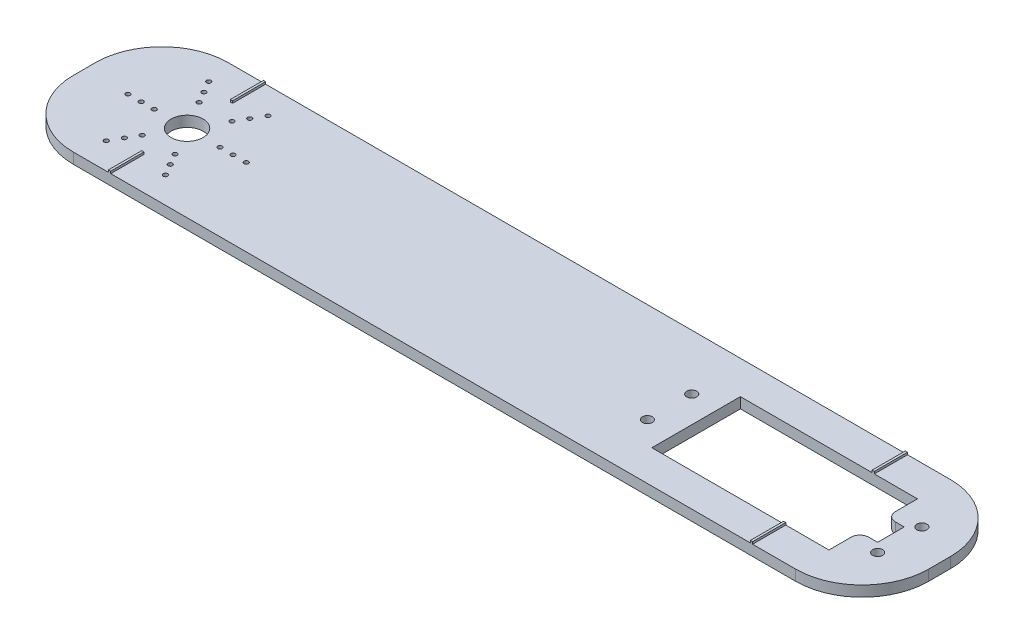
from build123d import *

# Parameters (mm, degrees)
SKETCH1_W           = 193.2
SKETCH1_H           = 35
BOSS_EXTRUDE1_DEPTH = 2.4
SKETCH2_R           = 1.13
SKETCH2_R_2         = 3.625
SKETCH2_R_3         = 0.5
SKETCH2_W           = 40
SKETCH2_H           = 20
CUT_EXTRUDE1_DEPTH  = 2.4
SKETCH4_W           = 4
SKETCH4_H           = 6
CUT_EXTRUDE2_DEPTH  = 2.4
FILLET1_R           = 15
FILLET2_R           = 2
SKETCH5_W           = 0.5
SKETCH5_H           = 7.5
BOSS_EXTRUDE2_DEPTH = 0.5


with BuildPart() as part:
    # Sketch1 → Boss-Extrude1 (new body)
    with BuildSketch(Plane(origin=(0, 0, 0), x_dir=(1, 0, 0), z_dir=(0, 1, 0))):
        with Locations((30.922946176, 21.495750708)):
            Rectangle(SKETCH1_W, SKETCH1_H)
    extrude(amount=BOSS_EXTRUDE1_DEPTH)

    # Sketch2 → Cut-Extrude1 (cut)
    with BuildSketch(Plane(origin=(0, 2.4, 0), x_dir=(1, 0, 0), z_dir=(0, 1, 0))):
        with Locations(Location((66.522946176, 26.495750708, 0), (0, 0, 270))):
            Circle(SKETCH2_R)
        with Locations(Location((118.522946176, 26.495750708, 0), (0, 0, 270))):
            Circle(SKETCH2_R)
        with Locations(Location((118.522946176, 16.495750708, 0), (0, 0, 90))):
            Circle(SKETCH2_R)
        with Locations(Location((66.522946176, 16.495750708, 0), (0, 0, 90))):
            Circle(SKETCH2_R)
        with Locations(Location((-42.477053824, 21.495750708, 0), (0, 0, 270))):
            Circle(SKETCH2_R_2)
        with Locations(Location((-49.907053824, 21.495750708, 0), (0, 0, 270))):
            Circle(SKETCH2_R_3)
        with Locations(Location((-52.842053824, 21.495750708, 0), (0, 0, 270))):
            Circle(SKETCH2_R_3)
        with Locations(Location((-55.847053824, 21.495750708, 0), (0, 0, 270))):
            Circle(SKETCH2_R_3)
        with Locations(Location((-49.162053824, 33.074510357, 0), (0, 0, 270))):
            Circle(SKETCH2_R_3)
        with Locations(Location((-47.659553824, 30.472104018, 0), (0, 0, 270))):
            Circle(SKETCH2_R_3)
        with Locations(Location((-46.192053824, 27.930319458, 0), (0, 0, 270))):
            Circle(SKETCH2_R_3)
        with Locations(Location((-35.792053824, 33.074510357, 0), (0, 0, 270))):
            Circle(SKETCH2_R_3)
        with Locations(Location((-37.294553824, 30.472104018, 0), (0, 0, 270))):
            Circle(SKETCH2_R_3)
        with Locations(Location((-38.762053824, 27.930319458, 0), (0, 0, 270))):
            Circle(SKETCH2_R_3)
        with Locations(Location((-29.107053824, 21.495750708, 0), (0, 0, 270))):
            Circle(SKETCH2_R_3)
        with Locations(Location((-32.112053824, 21.495750708, 0), (0, 0, 270))):
            Circle(SKETCH2_R_3)
        with Locations(Location((-35.047053824, 21.495750708, 0), (0, 0, 270))):
            Circle(SKETCH2_R_3)
        with Locations(Location((-35.792053824, 9.91699106, 0), (0, 0, 270))):
            Circle(SKETCH2_R_3)
        with Locations(Location((-37.294553824, 12.519397398, 0), (0, 0, 270))):
            Circle(SKETCH2_R_3)
        with Locations(Location((-38.762053824, 15.061181958, 0), (0, 0, 270))):
            Circle(SKETCH2_R_3)
        with Locations(Location((-49.162053824, 9.91699106, 0), (0, 0, 270))):
            Circle(SKETCH2_R_3)
        with Locations(Location((-47.659553824, 12.519397398, 0), (0, 0, 270))):
            Circle(SKETCH2_R_3)
        with Locations(Location((-46.192053824, 15.061181958, 0), (0, 0, 270))):
            Circle(SKETCH2_R_3)
        with Locations((92.522946176, 21.495750708)):
            Rectangle(SKETCH2_W, SKETCH2_H)
    extrude(amount=-CUT_EXTRUDE1_DEPTH, mode=Mode.SUBTRACT)

    # Sketch4 → Cut-Extrude2 (cut)
    with BuildSketch(Plane(origin=(0, 2.4, 0), x_dir=(1, 0, 0), z_dir=(0, 1, 0))):
        with Locations((114.522946176, 21.495750708)):
            Rectangle(SKETCH4_W, SKETCH4_H)
    extrude(amount=-CUT_EXTRUDE2_DEPTH, mode=Mode.SUBTRACT)

    # Fillet1
    fillet1_edges = [part.edges().sort_by_distance(p)[0] for p in [
        (-65.677053824, 1.2, -38.995750708),
        (127.522946176, 1.2, -38.995750708),
        (127.522946176, 1.2, -3.995750708),
        (-65.677053824, 1.2, -3.995750708),
    ]]
    fillet(fillet1_edges, radius=FILLET1_R)

    # Fillet2
    fillet2_edges = [part.edges().sort_by_distance(p)[0] for p in [
        (112.522946176, 1.2, -18.495750708),
        (112.522946176, 1.2, -24.495750708),
    ]]
    fillet(fillet2_edges, radius=FILLET2_R)

    # Sketch5 → Boss-Extrude2 (add)
    with BuildSketch(Plane(origin=(0, 2.4, 0), x_dir=(1, 0, 0), z_dir=(0, 1, 0))):
        with Locations((102.522946176, 35.245750708)):
            Rectangle(SKETCH5_W, SKETCH5_H)
        with Locations((102.522946176, 7.745750708)):
            Rectangle(SKETCH5_W, SKETCH5_H)
        with Locations((-42.477053824, 7.745750708)):
            Rectangle(SKETCH5_W, SKETCH5_H)
        with Locations((-42.477053824, 35.245750708)):
            Rectangle(SKETCH5_W, SKETCH5_H)
    extrude(amount=BOSS_EXTRUDE2_DEPTH)


solid = part.part
